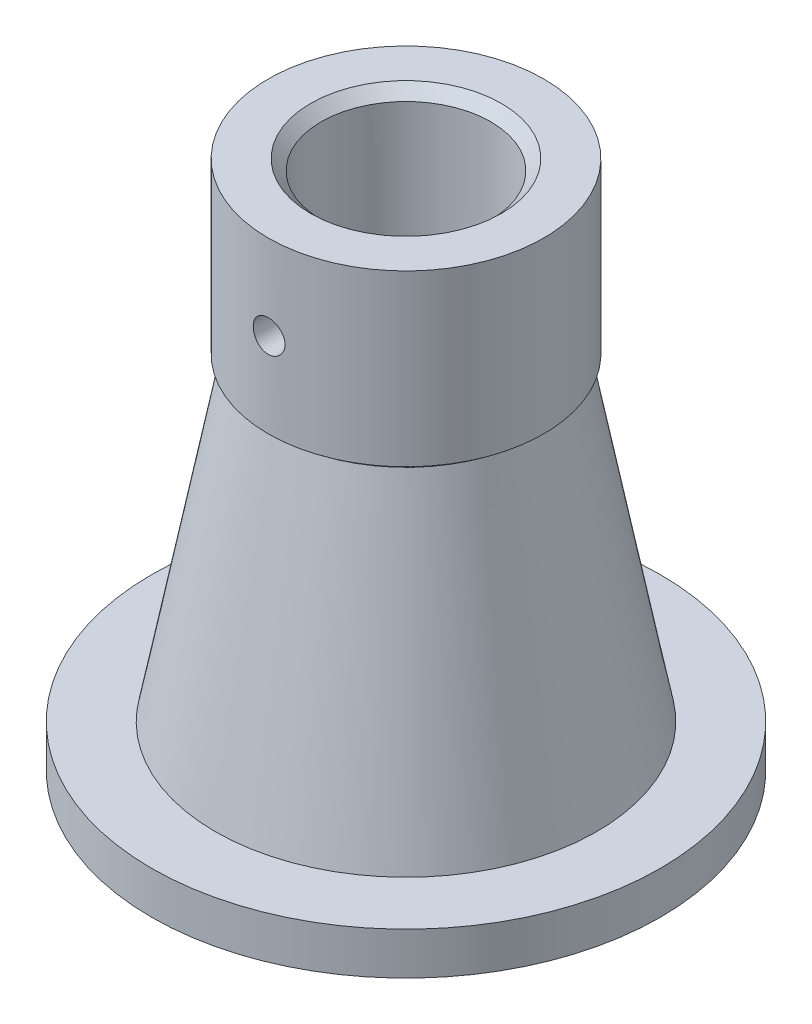
from build123d import *

# Parameters (mm, degrees)
CHAMFER1_SIZE           = 5
CUT_EXTRUDE1_REACH      = 304.159
CUT_EXTRUDE1_END_RADIUS = 65
SKETCH2_R               = 7.5


with BuildPart() as part:
    # Sketch1 → Revolve1 (revolve)
    with BuildSketch(Plane.XY, mode=Mode.PRIVATE) as revolve1_sk:
        with BuildLine():
            Line((80, 0), (120, 0))
            Line((120, 0), (120, 20))
            Line((120, 20), (90, 20))
            Line((90, 20), (61.860013717, 167.541531884))
            ThreePointArc((61.860013717, 167.541531884), (62.662860491, 168.934123661), (63.866098802, 170))
            Line((63.866098802, 170), (65, 170))
            Line((65, 170), (65, 250))
            Line((65, 250), (40, 250))
            Line((40, 250), (40, 170))
            Line((40, 170), (45, 170))
            ThreePointArc((45, 170), (46.885443724, 168.906865887), (48.126751856, 167.115499273))
            Line((48.126751856, 167.115499273), (80, 0))
        make_face()
    revolve(revolve1_sk.sketch.rotate(Axis((0, 126.434782609, 0), (0, -1, 0)), 90), axis=Axis((0, 126.434782609, 0), (0, -1, 0)))

    # Chamfer1
    chamfer1_edges = [part.edges().sort_by_distance(p)[0] for p in [
        (0, 250, -40),
    ]]
    chamfer(chamfer1_edges, length=CHAMFER1_SIZE)

    # Cut-Extrude1: up to this cylinder (the profile starts inside it)
    cut_extrude1_end = Plane(origin=(0, 210, 0), z_dir=(0, 1, 0)) * Cylinder(CUT_EXTRUDE1_END_RADIUS, 739.318, mode=Mode.PRIVATE)
    # Sketch2 → Cut-Extrude1 (cut, up to the surface)
    with BuildSketch(Plane.XY, mode=Mode.PRIVATE) as cut_extrude1_sk1:
        with Locations(Location((0, 210, 0), (0, 0, 180))):
            Circle(SKETCH2_R)
    cut_extrude1_tool1 = extrude(cut_extrude1_sk1.sketch, amount=CUT_EXTRUDE1_REACH, mode=Mode.PRIVATE) & cut_extrude1_end
    add(cut_extrude1_tool1.solids().sort_by_distance((0, 210, 0))[0], mode=Mode.SUBTRACT)


solid = part.part
